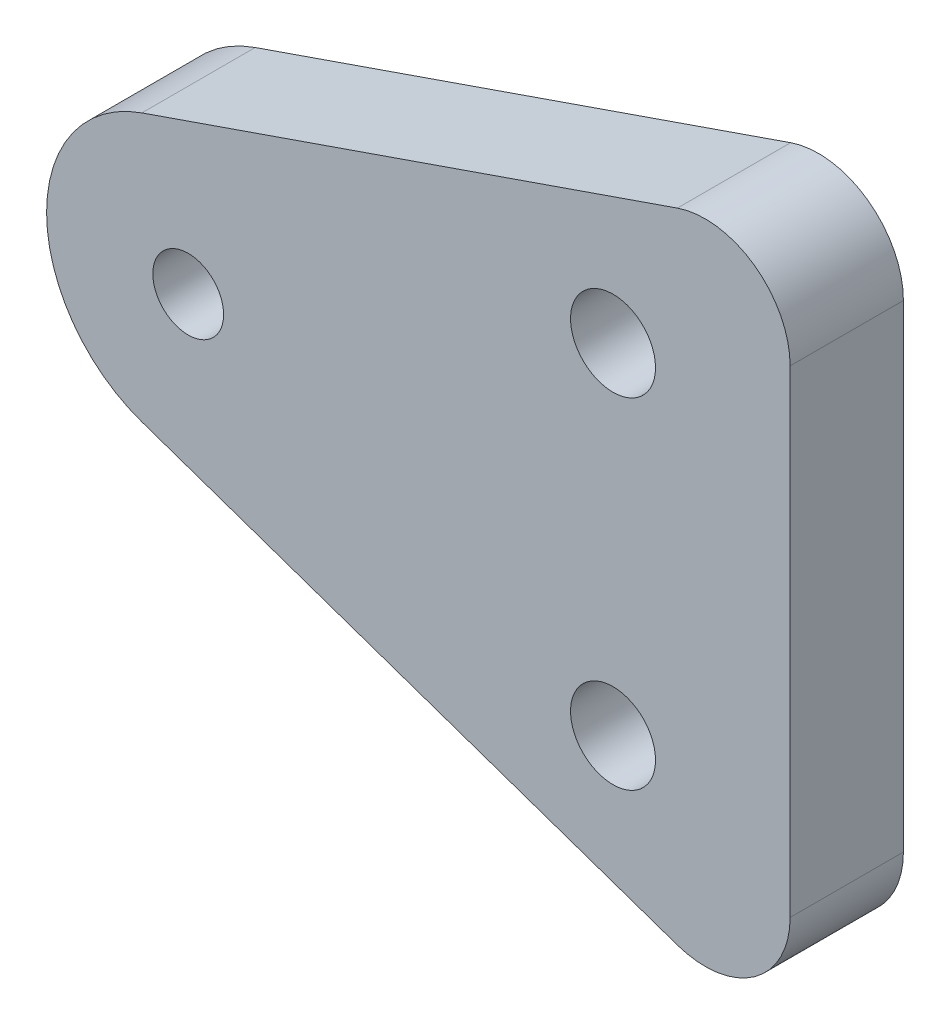
from build123d import *

# Parameters (mm, degrees)
SKETCH_1_R      = 1.25
SKETCH_1_R_2    = 1.5
EXTRUDE_1_DEPTH = 4
FILLET_1_R      = 3


with BuildPart() as part:
    # 草图1 → 凸台-拉伸1 (new body)
    with BuildSketch(Plane.XY):
        with BuildLine():
            Line((-6.635089387, 15.274909239), (16.252937679, 7.354644413))
            Line((16.252937679, 7.354644413), (16.252937679, 32.645355587))
            Line((16.252937679, 32.645355587), (-6.635089387, 24.725090761))
            ThreePointArc((-6.635089387, 24.725090761), (-10, 20), (-6.635089387, 15.274909239))
        make_face()
        with Locations((-5, 20)):
            Circle(SKETCH_1_R, mode=Mode.SUBTRACT)
        with Locations((10, 26)):
            Circle(SKETCH_1_R_2, mode=Mode.SUBTRACT)
        with Locations((10, 14)):
            Circle(SKETCH_1_R_2, mode=Mode.SUBTRACT)
    extrude(amount=EXTRUDE_1_DEPTH)

    # 圆角1
    fillet_1_edges = [part.edges().sort_by_distance(p)[0] for p in [
        (16.252937679, 32.645355587, 2),
        (16.252937679, 7.354644413, 2),
    ]]
    fillet(fillet_1_edges, radius=FILLET_1_R)


solid = part.part
